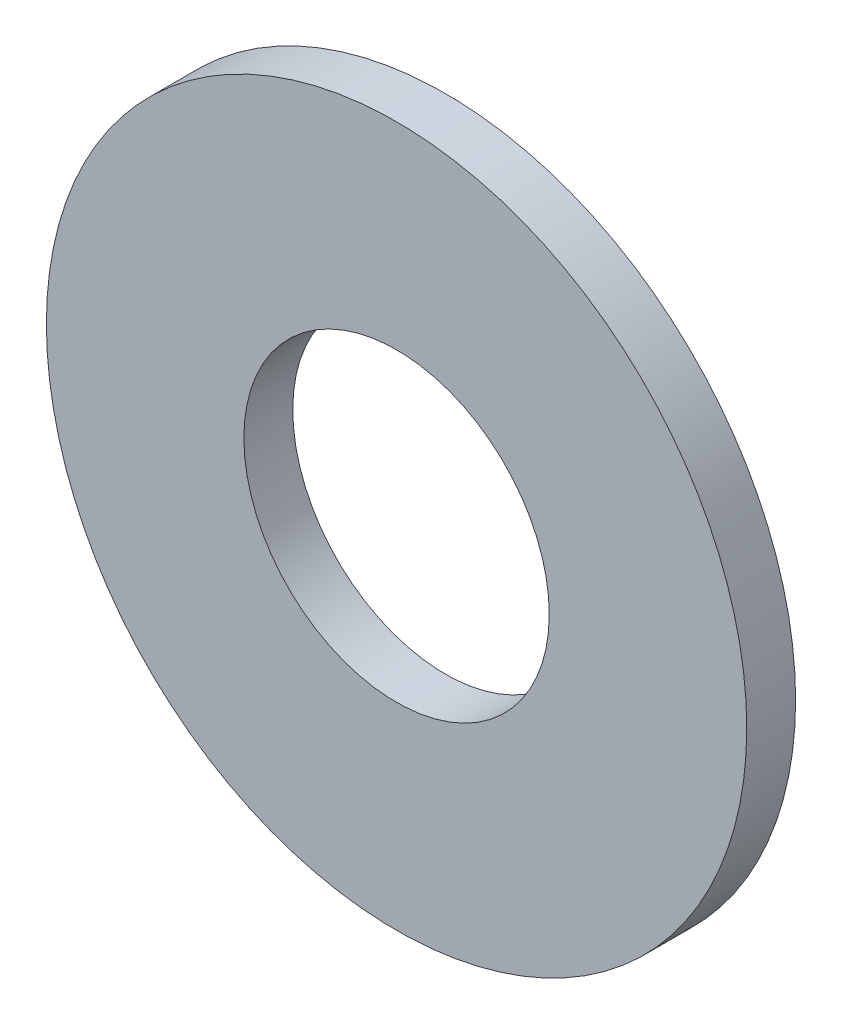
from build123d import *

# Parameters (mm, degrees)
SKETCH_1_R      = 86
SKETCH_1_R_2    = 37.5
EXTRUDE_1_DEPTH = 12


with BuildPart() as part:
    # 草图1 → 凸台-拉伸1 (new body)
    with BuildSketch(Plane.XY):
        Circle(SKETCH_1_R)
        Circle(SKETCH_1_R_2, mode=Mode.SUBTRACT)
    extrude(amount=EXTRUDE_1_DEPTH)


solid = part.part
